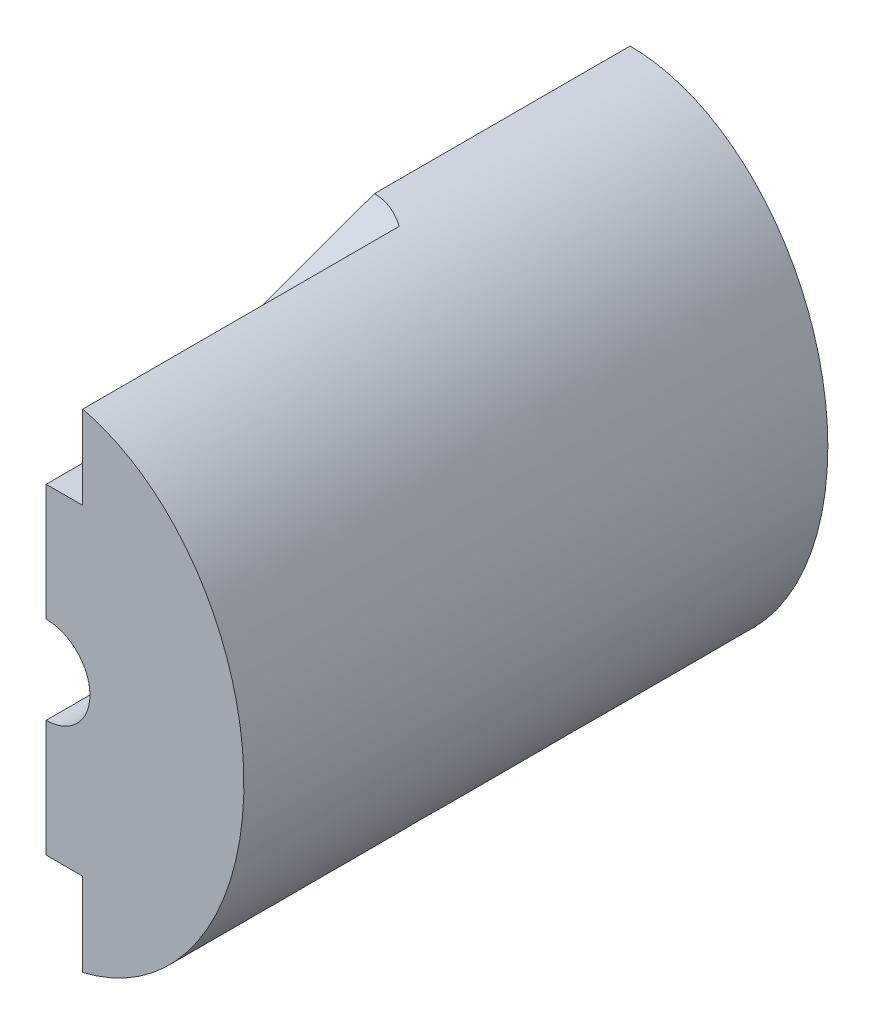
from build123d import *

# Parameters (mm, degrees)
CROQUIS1_RX             = 85
CROQUIS1_RY             = 67.73101263
SALIENTE_EXTRUIR1_DEPTH = 200
CORTAR_EXTRUIR1_DEPTH   = 100
SALIENTE_EXTRUIR2_DEPTH = 30
CROQUIS5_R              = 7.5
SALIENTE_EXTRUIR3_DEPTH = 30
CORTAR_EXTRUIR3_DEPTH   = 30
CROQUIS8_W              = 78.88877914
CROQUIS8_H              = 202.201910825
CORTAR_EXTRUIR4_DEPTH   = 348.816388214
CROQUIS9_R              = 15
CORTAR_EXTRUIR5_DEPTH   = 20
CROQUIS10_R             = 7.5
CORTAR_EXTRUIR6_DEPTH   = 8
CORTAR_EXTRUIR7_DEPTH   = 12.5


with BuildPart() as part:
    # Croquis1 → Saliente-Extruir1 (new body)
    with BuildSketch(Plane.XY):
        with Locations(Location((-119.067557665, 97.160736636), (0, 0, 90))):
            Ellipse(CROQUIS1_RX, CROQUIS1_RY)
    extrude(amount=SALIENTE_EXTRUIR1_DEPTH)

    # Croquis3 → Cortar-Extruir1 (cut)
    with BuildSketch(Plane.XY.offset(200)):
        with BuildLine():
            Line((-171.829854236, 137.159885706), (-171.829854236, 57.159885706))
            Line((-171.829854236, 57.159885706), (-178.829854236, 57.159885706))
            add(Edge.make_bspline(
                [(-178.830577491, 137.159885706), (-195.829371976, 97.159643663), (-178.829854236, 57.159885706)],
                knots=[1.080850346, 1.080850346, 1.080850346, 2.060764999, 2.060764999, 2.060764999], degree=2, weights=[1, 0.882352941, 1]))
            Line((-178.830577491, 137.159885706), (-171.829854236, 137.159885706))
        make_face()
    extrude(amount=-CORTAR_EXTRUIR1_DEPTH, mode=Mode.SUBTRACT)

    # Croquis4 → Saliente-Extruir2 (add)
    with BuildSketch(Plane.XY.offset(200)):
        with BuildLine():
            Line((-178.830577491, 137.159885706), (-171.829854236, 137.159885706))
            Line((-171.829854236, 137.159885706), (-171.829854236, 57.159885706))
            Line((-171.829854236, 57.159885706), (-178.829854236, 57.159885706))
            add(Edge.make_bspline(
                [(-178.830577491, 137.159885706), (-195.797797403, 97.186782087), (-178.829854236, 57.159885706)],
                knots=[4.219557052, 4.219557052, 4.219557052, 5.198274326, 5.198274326, 5.198274326], degree=2, weights=[1, 0.882634519, 1]))
        make_face()
    extrude(amount=-SALIENTE_EXTRUIR2_DEPTH)

    # Croquis5 → Saliente-Extruir3 (add)
    with BuildSketch(Plane(origin=(0, 0, 0), x_dir=(-1, 0, 0), z_dir=(0, 0, -1))):
        with Locations(Location((119.067557665, 97.160736636, 0), (0, 0, 180))):
            Circle(CROQUIS5_R)
    extrude(amount=SALIENTE_EXTRUIR3_DEPTH)

    # Croquis7 → Cortar-Extruir3 (cut)
    with BuildSketch(Plane.XY.offset(200)):
        with BuildLine():
            Line((-131.567557665, 42.160736636), (-106.567557665, 42.160736636))
            Line((-106.567557665, 42.160736636), (-106.567557665, 13.620827843))
            add(Edge.make_bspline(
                [(-131.567557665, 13.620827843), (-119.067557665, 10.675126293), (-106.567557665, 13.620827843)],
                knots=[6.0975677, 6.0975677, 6.0975677, 6.468802915, 6.468802915, 6.468802915], degree=2, weights=[1, 0.982822456, 1]))
            Line((-131.567557665, 13.620827843), (-131.567557665, 42.160736636))
        make_face()
        with BuildLine():
            Line((-131.567557665, 180.700645429), (-131.567557665, 152.160736636))
            Line((-131.567557665, 152.160736636), (-106.567557665, 152.160736636))
            Line((-106.567557665, 152.160736636), (-106.567557665, 180.700645429))
            add(Edge.make_bspline(
                [(-106.567557665, 180.700645429), (-119.067557665, 183.64634698), (-131.567557665, 180.700645429)],
                knots=[2.955975046, 2.955975046, 2.955975046, 3.327210261, 3.327210261, 3.327210261], degree=2, weights=[1, 0.982822456, 1]))
        make_face()
    extrude(amount=-CORTAR_EXTRUIR3_DEPTH, mode=Mode.SUBTRACT)

    # Croquis8 → Cortar-Extruir4 (cut, through all)
    with BuildSketch(Plane.XY.offset(200)):
        with Locations((-158.511947235, 101.100955412)):
            Rectangle(CROQUIS8_W, CROQUIS8_H)
    extrude(amount=-CORTAR_EXTRUIR4_DEPTH, mode=Mode.SUBTRACT)

    # Croquis9 → Cortar-Extruir5 (cut)
    with BuildSketch(Plane.XY.offset(200)):
        with Locations((-119.067557665, 97.160736636)):
            Circle(CROQUIS9_R)
    extrude(amount=-CORTAR_EXTRUIR5_DEPTH, mode=Mode.SUBTRACT)

    # Croquis10 → Cortar-Extruir6 (cut)
    with BuildSketch(Plane.ZY.offset(106.567557665)):
        with Locations((185, 169.660736636)):
            Circle(CROQUIS10_R)
        with Locations((185, 24.660736636)):
            Circle(CROQUIS10_R)
    extrude(amount=-CORTAR_EXTRUIR6_DEPTH, mode=Mode.SUBTRACT)

    # Croquis11 → Cortar-Extruir7 (cut)
    with BuildSketch(Plane.ZY.offset(119.067557665)):
        Polygon((170, 152.160736636), (81.545095526, 184.35568894), (86.604252386, 216.899683734), (170, 209.051385078), align=None)
        Polygon((170, 42.160736636), (54.164328104, 0), (170, 0), align=None)
    extrude(amount=-CORTAR_EXTRUIR7_DEPTH, mode=Mode.SUBTRACT)


solid = part.part
